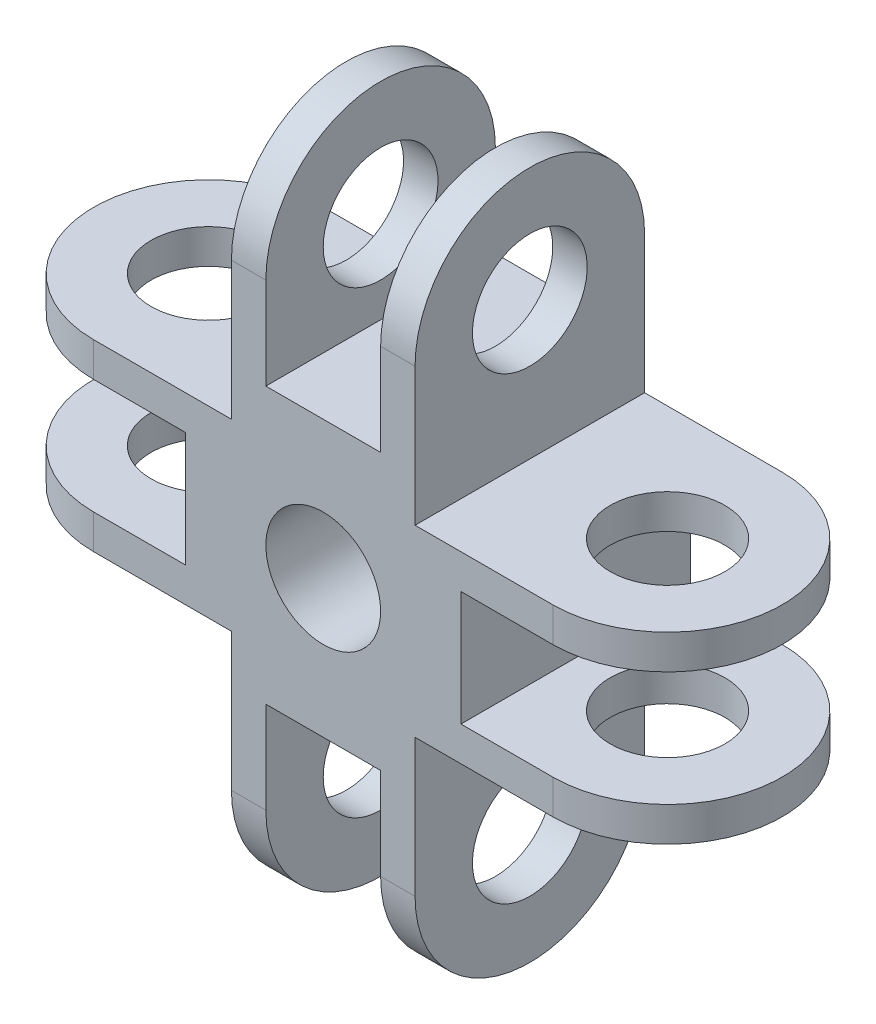
from build123d import *

# Parameters (mm, degrees)
SKETCH_1_R               = 5
SKETCH_1_R_2             = 2.5
EXTRUDE_1_DEPTH          = 10
SKETCH_2_R               = 2.5
EXTRUDE_2_DEPTH          = 4
PATTERN_CIRCULAR_1_COUNT = 4
CUT_EXTRUDE_2_DEPTH      = 2.5
PATTERN_CIRCULAR_2_COUNT = 4
EXTRUDE_5_DEPTH          = 10
PATTERN_CIRCULAR_3_COUNT = 4


with BuildPart() as part:
    # 草图1 → 凸台-拉伸1 (new body)
    with BuildSketch(Plane.XY):
        Circle(SKETCH_1_R)
        Circle(SKETCH_1_R_2, mode=Mode.SUBTRACT)
    extrude(amount=EXTRUDE_1_DEPTH)

    # 草图2 → 凸台-拉伸2 (add, symmetric)
    with BuildSketch(Plane(origin=(0, 0, 0), x_dir=(1, 0, 0), z_dir=(0, 1, 0))):
        with BuildLine():
            Line((-5, 0), (-10, 0))
            ThreePointArc((-10, 0), (-15, -5), (-10, -10))
            Line((-10, -10), (-5, -10))
            Line((-5, -10), (-4.632725414, -10))
            Line((-4.632725414, -10), (-3.973155126, -10))
            Line((-3.973155126, -10), (-3.973155126, 0))
            Line((-3.973155126, 0), (-4.632725414, 0))
            Line((-4.632725414, 0), (-5, 0))
        make_face()
        with Locations(Location((-10, -5, 0), (0, 0, 270))):
            Circle(SKETCH_2_R, mode=Mode.SUBTRACT)
    extrude_2 = extrude(amount=EXTRUDE_2_DEPTH, both=True)

    # 阵列(圆周)1: 凸台-拉伸2 ×4 about axis
    pattern_circular_1_axis = Axis((0, 0, 0), (0, 0, 1))
    for i in range(1, PATTERN_CIRCULAR_1_COUNT):
        add(extrude_2.rotate(pattern_circular_1_axis, i * 360 / PATTERN_CIRCULAR_1_COUNT))

    # 草图4 → 切除-拉伸2 (cut, symmetric)
    with BuildSketch(Plane(origin=(0, 0, 0), x_dir=(1, 0, 0), z_dir=(0, 1, 0))):
        with BuildLine():
            Line((-10, 0), (-6, 0))
            Line((-6, 0), (-6, -10))
            Line((-6, -10), (-10, -10))
            ThreePointArc((-10, -10), (-15, -5), (-10, 0))
        make_face()
    cut_extrude_2 = extrude(amount=CUT_EXTRUDE_2_DEPTH, both=True, mode=Mode.SUBTRACT)

    # 阵列(圆周)2: 切除-拉伸2 ×4 about axis
    pattern_circular_2_axis = Axis((0, 0, 0), (0, 0, 1))
    for i in range(1, PATTERN_CIRCULAR_2_COUNT):
        add(cut_extrude_2.rotate(pattern_circular_2_axis, i * 360 / PATTERN_CIRCULAR_2_COUNT), mode=Mode.SUBTRACT)

    # 草图5 → 凸台-拉伸5 (add)
    with BuildSketch(Plane(origin=(0, 0, 0), x_dir=(-1, 0, 0), z_dir=(0, 0, -1))):
        Polygon((-3.973155126, 3.973155126), (-3.035463449, 3.973155126), (-3.973155126, 3.035463449), align=None)
    extrude_5 = extrude(amount=-EXTRUDE_5_DEPTH)

    # 阵列(圆周)3: 凸台-拉伸5 ×4 about axis
    pattern_circular_3_axis = Axis((0, 0, 0), (0, 0, -1))
    for i in range(1, PATTERN_CIRCULAR_3_COUNT):
        add(extrude_5.rotate(pattern_circular_3_axis, i * 360 / PATTERN_CIRCULAR_3_COUNT))


solid = part.part
